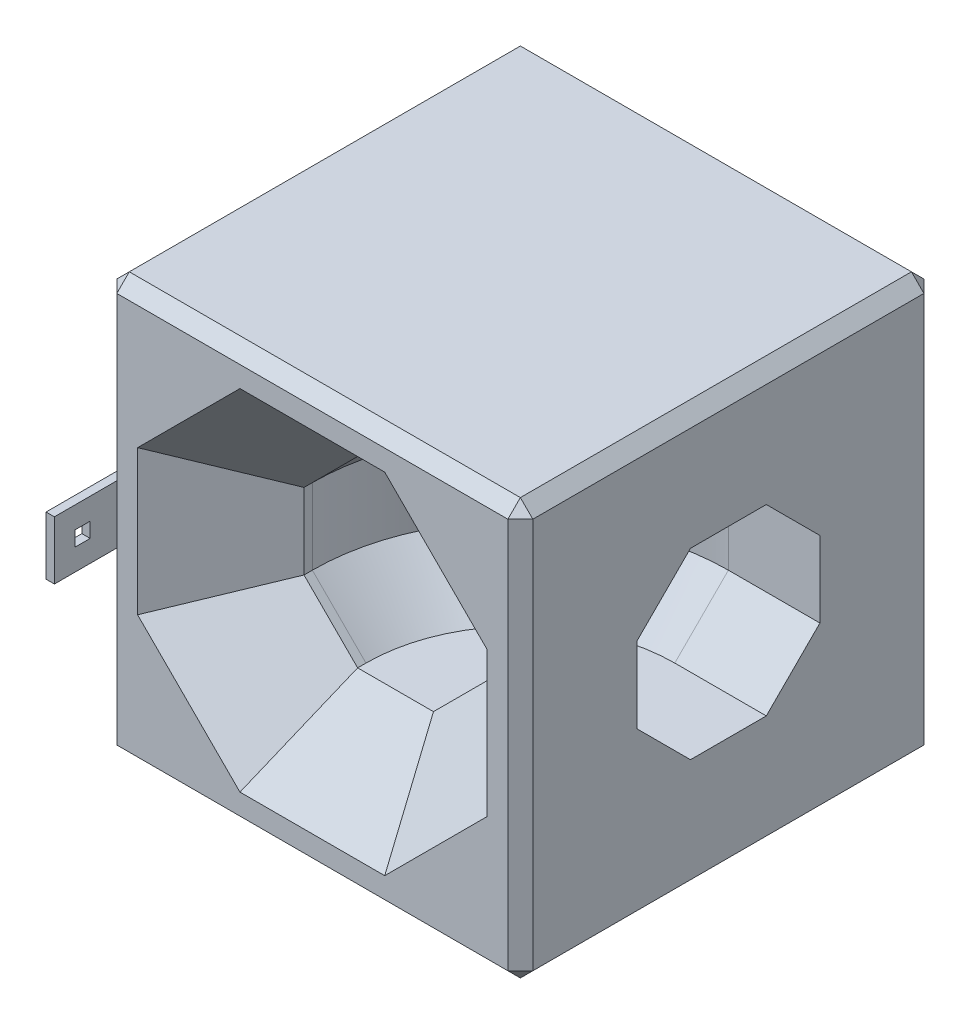
from build123d import *

# Parameters (mm, degrees)
SKETCH1_W                = 50
SKETCH1_H                = 50
BOSS_EXTRUDE1_DEPTH      = 50
CHAMFER1_SIZE            = 10
CHAMFER2_SIZE            = 1.5
BOSS_EXTRUDE2_DEPTH      = 7
BOSS_EXTRUDE2_DEPTH_BACK = 10
SKETCH10_W               = 1
SKETCH10_H               = 7
SKETCH11_W               = 1.8
SKETCH11_H               = 1.8
CUT_EXTRUDE1_DEPTH       = 7


with BuildPart() as part:
    # Sketch1 → Boss-Extrude1 (new body)
    with BuildSketch(Plane.XY):
        with Locations((25, 25)):
            Rectangle(SKETCH1_W, SKETCH1_H)
    extrude(amount=BOSS_EXTRUDE1_DEPTH)

    # Cut-Sweep5: sweep along a path in Sketch9
    with BuildLine(Plane(origin=(0, 25, 0), x_dir=(-1, 0, 0), z_dir=(0, -1, 0))) as cut_sweep5_path:
        Line((-50, -25), (-39, -25))
        ThreePointArc((-39, -25), (-29.100505063, -29.100505063), (-25, -39))
        Line((-25, -39), (-25, -50))
    # Sketch8 → Cut-Sweep5 (sweep, cut)
    with BuildSketch(Plane(origin=(50, 0, 0), x_dir=(0, 0, -1), z_dir=(1, 0, 0))):
        Polygon((-14, 29.556349186), (-20.443650814, 36), (-29.556349186, 36), (-36, 29.556349186), (-36, 20.443650814), (-29.556349186, 14), (-20.443650814, 14), (-14, 20.443650814), align=None)
    sweep(path=cut_sweep5_path.line, mode=Mode.SUBTRACT)

    # Chamfer1
    chamfer1_edges = [part.edges().sort_by_distance(p)[0] for p in [
        (17.221825407, 17.221825407, 50),
        (32.778174593, 17.221825407, 50),
        (36, 25, 50),
        (32.778174593, 32.778174593, 50),
        (17.221825407, 32.778174593, 50),
        (14, 25, 50),
        (25, 14, 50),
        (25, 36, 50),
    ]]
    chamfer(chamfer1_edges, length=CHAMFER1_SIZE)

    # Chamfer2
    chamfer2_edges = [part.edges().sort_by_distance(p)[0] for p in [
        (50, 25, 50),
        (25, 50, 50),
        (0, 25, 50),
        (25, 50, 0),
        (50, 25, 0),
        (25, 0, 0),
        (0, 25, 0),
        (25, 0, 50),
        (0, 50, 25),
        (50, 50, 25),
        (50, 0, 25),
        (0, 0, 25),
    ]]
    chamfer(chamfer2_edges, length=CHAMFER2_SIZE)

    # Sketch10 → Boss-Extrude2 (add, two sides: drawn at the far end of the back side and taken through both)
    with BuildSketch(Plane.XY.offset(50).offset(-BOSS_EXTRUDE2_DEPTH_BACK)):
        with Locations((0.5, 25)):
            Rectangle(SKETCH10_W, SKETCH10_H)
    extrude(amount=BOSS_EXTRUDE2_DEPTH + BOSS_EXTRUDE2_DEPTH_BACK)

    # Sketch11 → Cut-Extrude1 (cut)
    with BuildSketch(Plane(origin=(1, 0, 0), x_dir=(0, 0, -1), z_dir=(1, 0, 0))):
        with Locations((-53.6, 25)):
            Rectangle(SKETCH11_W, SKETCH11_H)
    extrude(amount=-CUT_EXTRUDE1_DEPTH, mode=Mode.SUBTRACT)


solid = part.part
